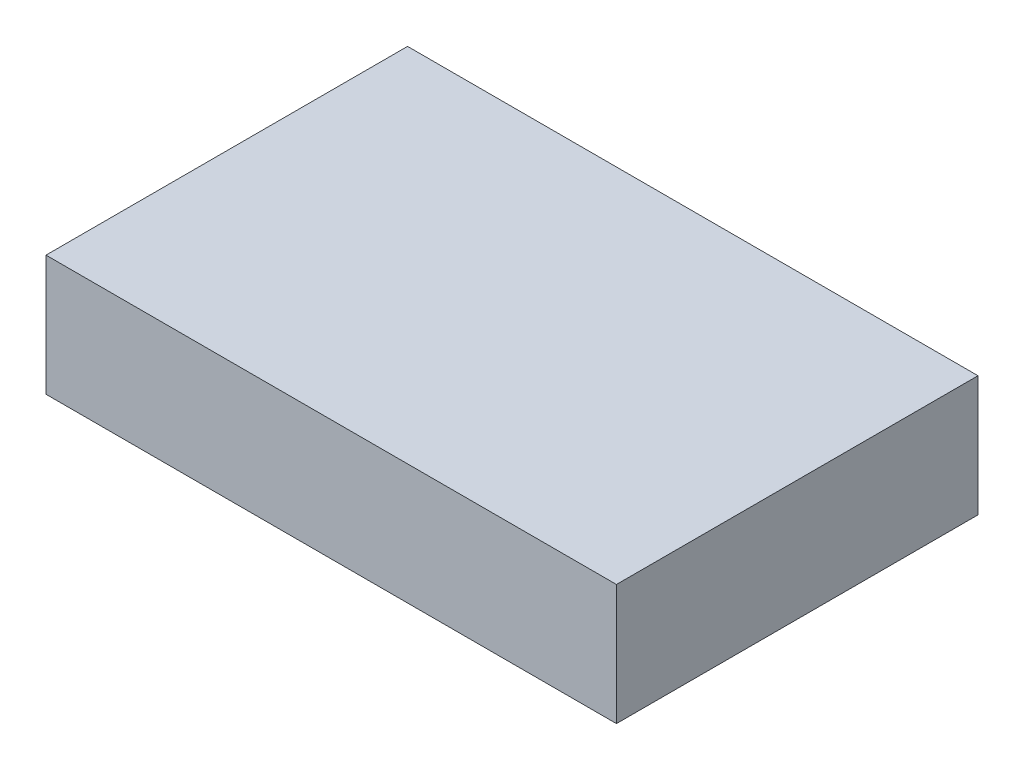
from build123d import *

# Parameters (mm, degrees)
SKETCH_1_W      = 71
SKETCH_1_H      = 45
EXTRUDE_1_DEPTH = 15


with BuildPart() as part:
    # 草图1 → 凸台-拉伸1 (new body)
    with BuildSketch(Plane(origin=(0, 0, 0), x_dir=(1, 0, 0), z_dir=(0, 1, 0))):
        with Locations((35.5, 22.5)):
            Rectangle(SKETCH_1_W, SKETCH_1_H)
    extrude(amount=EXTRUDE_1_DEPTH)


solid = part.part
